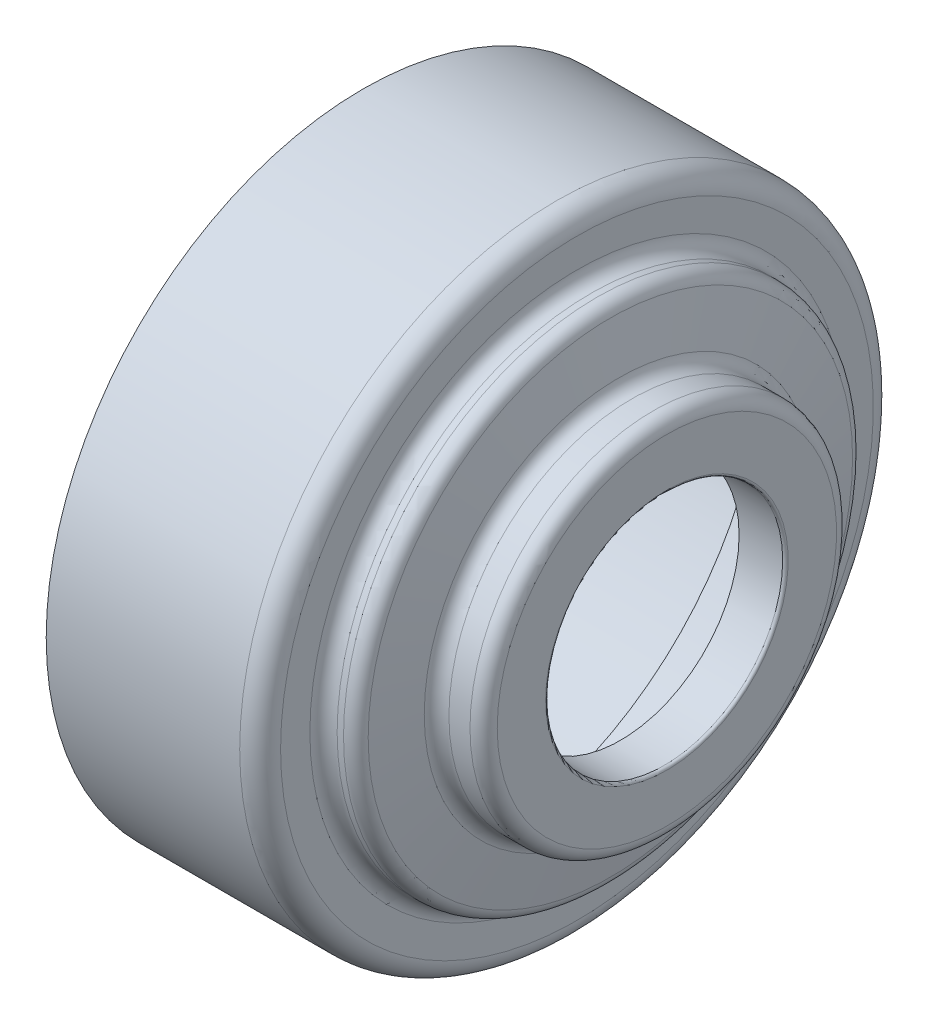
from build123d import *

# Parameters (mm, degrees)
FILLET_1_R = 0.2
FILLET_2_R = 1
FILLET_3_R = 1.5


with BuildPart() as part:
    # 草图2 → 旋转1 (revolve)
    with BuildSketch(Plane.XY, mode=Mode.PRIVATE) as revolve_1_sk:
        Polygon((-14.5, 22), (-6.5, 22), (-6.5, 21.4), (0, 21.4), (0, 17.4), (2.5, 17.4), (3.408083951, 12.25), (6.6, 12.25), (6.6, 9.4), (4.4, 9.4), (4.4, 8.7), (7.8, 8.7), (7.8, 13.45), (4.415003508, 13.45), (3.506919557, 18.6), (1.2, 18.6), (1.2, 23.25), (-14.5, 23.25), align=None)
    revolve(revolve_1_sk.sketch.rotate(Axis((-36.936605317, 0, 0), (1, 0, 0)), 90), axis=Axis((-36.936605317, 0, 0), (1, 0, 0)))

    # 圆角1
    fillet_1_edges = [part.edges().sort_by_distance(p)[0] for p in [
        (0, 0, -21.4),
        (0, 0, -17.4),
        (2.5, 0, -17.4),
        (6.6, 0, -12.25),
        (7.8, 0, -8.7),
    ]]
    fillet(fillet_1_edges, radius=FILLET_1_R)

    # 圆角2
    fillet_2_edges = [part.edges().sort_by_distance(p)[0] for p in [
        (7.8, 0, -13.45),
        (4.415003508, 0, -13.45),
        (3.506919557, 0, -18.6),
        (1.2, 0, -18.6),
    ]]
    fillet(fillet_2_edges, radius=FILLET_2_R)

    # 圆角3
    fillet_3_edges = [part.edges().sort_by_distance(p)[0] for p in [
        (3.408083951, 0, -12.25),
        (1.2, 0, -23.25),
    ]]
    fillet(fillet_3_edges, radius=FILLET_3_R)


solid = part.part
